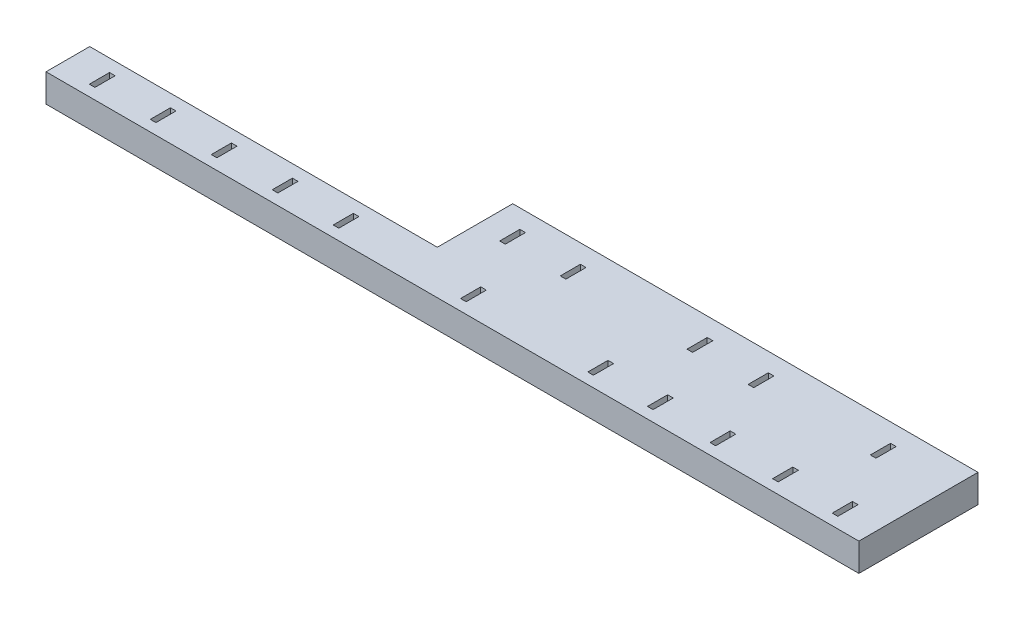
from build123d import *

# Parameters (mm, degrees)
SKETCH1_W           = 145
SKETCH1_H           = 35
SKETCH1_W_2         = 1
SKETCH1_H_2         = 3.6
BOSS_EXTRUDE1_DEPTH = 5
CUT_EXTRUDE1_REACH  = 76.75
SKETCH2_W           = 145
SKETCH2_H           = 13.752262189
SKETCH2_W_2         = 62.00633413
SKETCH2_H_2         = 13.452443164
SKETCH4_R           = 1.9
CUT_EXTRUDE2_DEPTH  = 3


with BuildPart() as part:
    # Sketch1 → Boss-Extrude1 (new body)
    with BuildSketch(Plane(origin=(0, 0, 0), x_dir=(1, 0, 0), z_dir=(0, 1, 0))):
        Rectangle(SKETCH1_W, SKETCH1_H)
        Rectangle(SKETCH1_W_2, SKETCH1_H_2, mode=Mode.SUBTRACT)
        with Locations((-22.72, 0)):
            Rectangle(SKETCH1_W_2, SKETCH1_H_2, mode=Mode.SUBTRACT)
        with Locations((-33.595, 0)):
            Rectangle(SKETCH1_W_2, SKETCH1_H_2, mode=Mode.SUBTRACT)
        with Locations((-44.47, 0)):
            Rectangle(SKETCH1_W_2, SKETCH1_H_2, mode=Mode.SUBTRACT)
        with Locations((-55.345, 0)):
            Rectangle(SKETCH1_W_2, SKETCH1_H_2, mode=Mode.SUBTRACT)
        with Locations((-66.22, 0)):
            Rectangle(SKETCH1_W_2, SKETCH1_H_2, mode=Mode.SUBTRACT)
        with Locations((22.7, 0)):
            Rectangle(SKETCH1_W_2, SKETCH1_H_2, mode=Mode.SUBTRACT)
        with Locations((33.337, 0)):
            Rectangle(SKETCH1_W_2, SKETCH1_H_2, mode=Mode.SUBTRACT)
        with Locations((44.499, 0)):
            Rectangle(SKETCH1_W_2, SKETCH1_H_2, mode=Mode.SUBTRACT)
        with Locations((55.661, 0)):
            Rectangle(SKETCH1_W_2, SKETCH1_H_2, mode=Mode.SUBTRACT)
        with Locations((66.298, 0)):
            Rectangle(SKETCH1_W_2, SKETCH1_H_2, mode=Mode.SUBTRACT)
        with Locations((-5.4, 12.38)):
            Rectangle(SKETCH1_W_2, SKETCH1_H_2, mode=Mode.SUBTRACT)
        with Locations((5.4, 12.38)):
            Rectangle(SKETCH1_W_2, SKETCH1_H_2, mode=Mode.SUBTRACT)
        with Locations((28.019, 12.38)):
            Rectangle(SKETCH1_W_2, SKETCH1_H_2, mode=Mode.SUBTRACT)
        with Locations((38.918, 12.38)):
            Rectangle(SKETCH1_W_2, SKETCH1_H_2, mode=Mode.SUBTRACT)
        with Locations((60.717, 12.38)):
            Rectangle(SKETCH1_W_2, SKETCH1_H_2, mode=Mode.SUBTRACT)
    extrude(amount=BOSS_EXTRUDE1_DEPTH)

    # Sketch2 → Cut-Extrude1 (cut, up to next)
    with BuildSketch(Plane(origin=(0, 5, 0), x_dir=(1, 0, 0), z_dir=(0, 1, 0)), mode=Mode.PRIVATE) as cut_extrude1_sk1:
        with Locations((0, -10.623868906)):
            Rectangle(SKETCH2_W, SKETCH2_H)
    cut_extrude1_tool1 = extrude(cut_extrude1_sk1.sketch, amount=-CUT_EXTRUDE1_REACH, mode=Mode.PRIVATE) & part.part
    # Sketch2 → Cut-Extrude1 (cut, up to next)
    with BuildSketch(Plane(origin=(0, 5, 0), x_dir=(1, 0, 0), z_dir=(0, 1, 0)), mode=Mode.PRIVATE) as cut_extrude1_sk2:
        with Locations((-41.496832935, 10.773778418)):
            Rectangle(SKETCH2_W_2, SKETCH2_H_2)
    cut_extrude1_tool2 = extrude(cut_extrude1_sk2.sketch, amount=-CUT_EXTRUDE1_REACH, mode=Mode.PRIVATE) & part.part
    add(cut_extrude1_tool1.solids().sort_by_distance((0, 5, 10.623869))[0], mode=Mode.SUBTRACT)
    add(cut_extrude1_tool2.solids().sort_by_distance((-41.496833, 5, -10.773778))[0], mode=Mode.SUBTRACT)

    # Sketch4 → Cut-Extrude2 (cut)
    with BuildSketch(Plane.XZ):
        with Locations(Location((0, 0, 0), (0, 0, 270))):
            Circle(SKETCH4_R)
        with Locations(Location((-5.4, -12.38, 0), (0, 0, 270))):
            Circle(SKETCH4_R)
        with Locations(Location((-22.72, 0, 0), (0, 0, 270))):
            Circle(SKETCH4_R)
        with Locations(Location((-33.595, 0, 0), (0, 0, 270))):
            Circle(SKETCH4_R)
        with Locations(Location((-44.47, 0, 0), (0, 0, 270))):
            Circle(SKETCH4_R)
        with Locations(Location((-55.345, 0, 0), (0, 0, 270))):
            Circle(SKETCH4_R)
        with Locations(Location((-66.22, 0, 0), (0, 0, 270))):
            Circle(SKETCH4_R)
        with Locations(Location((5.4, -12.38, 0), (0, 0, 270))):
            Circle(SKETCH4_R)
        with Locations(Location((22.7, 0, 0), (0, 0, 270))):
            Circle(SKETCH4_R)
        with Locations(Location((33.337, 0, 0), (0, 0, 270))):
            Circle(SKETCH4_R)
        with Locations(Location((44.499, 0, 0), (0, 0, 270))):
            Circle(SKETCH4_R)
        with Locations(Location((55.661, 0, 0), (0, 0, 270))):
            Circle(SKETCH4_R)
        with Locations(Location((66.298, 0, 0), (0, 0, 270))):
            Circle(SKETCH4_R)
        with Locations(Location((28.019, -12.38, 0), (0, 0, 270))):
            Circle(SKETCH4_R)
        with Locations(Location((38.918, -12.38, 0), (0, 0, 270))):
            Circle(SKETCH4_R)
        with Locations(Location((60.717, -12.38, 0), (0, 0, 270))):
            Circle(SKETCH4_R)
    extrude(amount=-CUT_EXTRUDE2_DEPTH, mode=Mode.SUBTRACT)


solid = part.part
